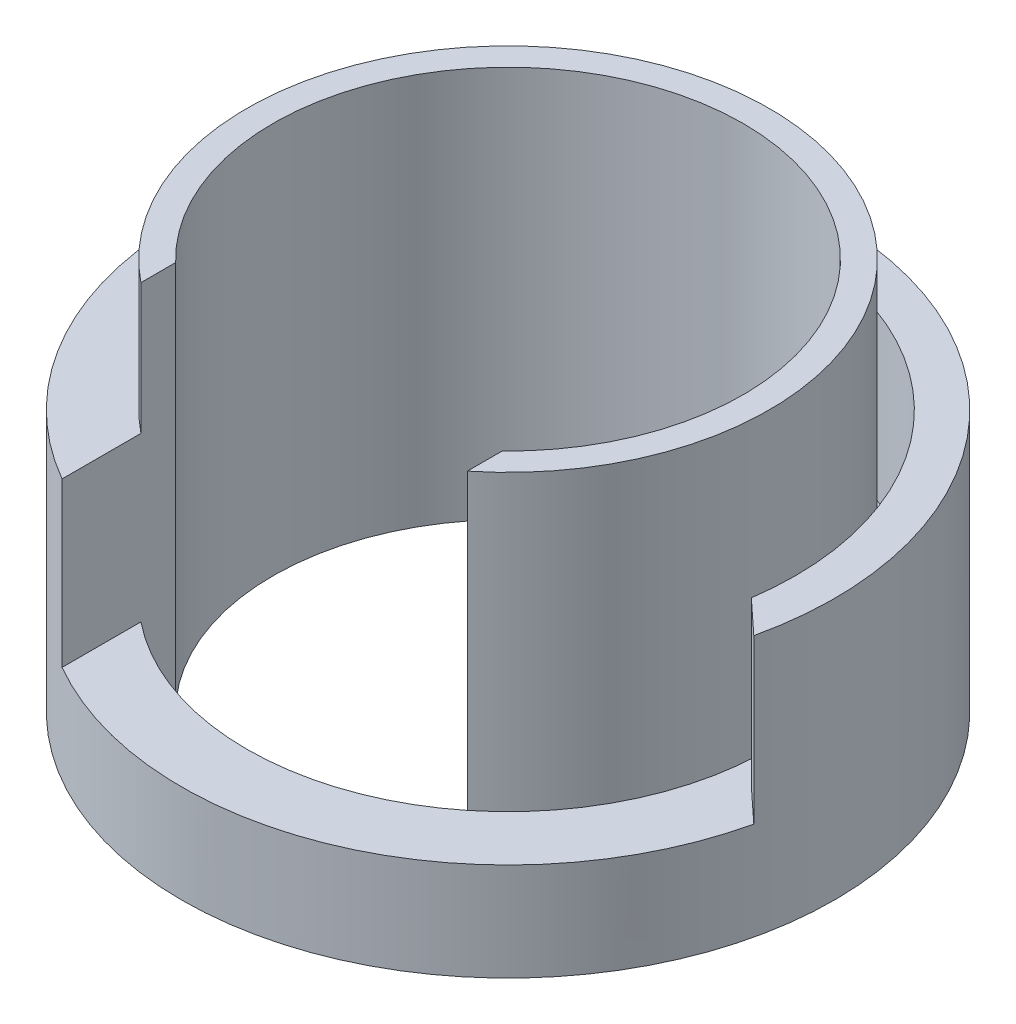
from build123d import *
from build123d.topology import SkipClean

# Parameters (mm, degrees)
ESBO_O1_R                            = 20
RESSALTO_EXTRUS_O2_DEPTH             = 20
RESSALTO_EXTRUS_O3_DEPTH             = 10
RESSALTO_EXTRUS_O3_DIRECTION_2_REACH = 42.62
CORTE_EXTRUS_O2_START                = -12.5
CORTE_EXTRUS_O2_DEPTH                = 12.5


with BuildPart() as part:
    # Esboço1 → Ressalto-extrusão2 (new body)
    with BuildSketch(Plane(origin=(0, 0, 0), x_dir=(1, 0, 0), z_dir=(0, 1, 0))):
        with BuildLine():
            ThreePointArc((-12.5, -21.650635095), (0, -25), (12.5, -21.650635095))
            ThreePointArc((12.5, -21.650635095), (21.650635095, -12.5), (25, 0))
            ThreePointArc((25, 0), (-12.5, 21.650635095), (-12.5, -21.650635095))
        make_face()
        with Locations(Location((0, 0, 0), (0, 0, 270))):
            Circle(ESBO_O1_R, mode=Mode.SUBTRACT)
    extrude(amount=RESSALTO_EXTRUS_O2_DEPTH)

    # Esboço2 → Ressalto-extrusão3 (add)
    with BuildSketch(Plane(origin=(0, 20, 0), x_dir=(1, 0, 0), z_dir=(0, 1, 0))):
        with BuildLine():
            Line((-12.5, -15.612494996), (-12.5, -12.951833847))
            ThreePointArc((-12.5, -12.951833847), (0, 18), (12.5, -12.951833847))
            Line((12.5, -12.951833847), (12.5, -15.612494996))
            ThreePointArc((12.5, -15.612494996), (0, 20), (-12.5, -15.612494996))
        make_face()
    extrude(amount=RESSALTO_EXTRUS_O3_DEPTH)

    # Ressalto-extrusão3 direction 2: up to this face of the body (flat: up to its plane)
    ressalto_extrus_o3_direction_2_end = Plane(part.part.faces().sort_by_distance((12.146446609, 0, -21.038262659))[0])
    # Esboço2 → Ressalto-extrusão3 direction 2 (add, up to the picked face)
    with BuildSketch(Plane(origin=(0, 20, 0), x_dir=(1, 0, 0), z_dir=(0, 1, 0)), mode=Mode.PRIVATE) as ressalto_extrus_o3_direction_2_sk1:
        with BuildLine():
            Line((-12.5, -15.612494996), (-12.5, -12.951833847))
            ThreePointArc((-12.5, -12.951833847), (0, 18), (12.5, -12.951833847))
            Line((12.5, -12.951833847), (12.5, -15.612494996))
            ThreePointArc((12.5, -15.612494996), (0, 20), (-12.5, -15.612494996))
        make_face()
    ressalto_extrus_o3_direction_2_tool1 = split(extrude(ressalto_extrus_o3_direction_2_sk1.sketch, amount=-RESSALTO_EXTRUS_O3_DIRECTION_2_REACH, mode=Mode.PRIVATE), bisect_by=ressalto_extrus_o3_direction_2_end, keep=Keep.BOTH, mode=Mode.PRIVATE)
    add(ressalto_extrus_o3_direction_2_tool1.solids().sort_by(Axis((13.03556, 20, 14.282164), (0, -1, 0)))[0])

    # Esboço3 → Corte-extrusão2 (cut)
    with SkipClean():  # the faces are left unmerged after this step: merging them gives an invalid solid
        with BuildSketch(Plane(origin=(0, 20, 0), x_dir=(1, 0, 0), z_dir=(0, 1, 0)).offset(CORTE_EXTRUS_O2_START)):
            with BuildLine():
                Line((-18.33030278, 17), (-14.664242224, 13.6))
                ThreePointArc((-14.664242224, 13.6), (19.945337297, 1.477673891), (-12.5, -15.612494996))
                Line((-12.5, -15.612494996), (-12.5, -21.650635095))
                ThreePointArc((-12.5, -21.650635095), (10, -22.912878475), (24.374507866, -5.557280474))
                Line((24.374507866, -5.557280474), (21.773974537, -3.145478163))
                ThreePointArc((21.773974537, -3.145478163), (17.493290141, 13.341094409), (2.726342097, 21.830415909))
                Line((2.726342097, 21.830415909), (3.098116019, 24.807290806))
                ThreePointArc((3.098116019, 24.807290806), (-8.558231465, 23.489501361), (-18.33030278, 17))
            make_face()
        extrude(amount=CORTE_EXTRUS_O2_DEPTH, mode=Mode.SUBTRACT)


solid = part.part
